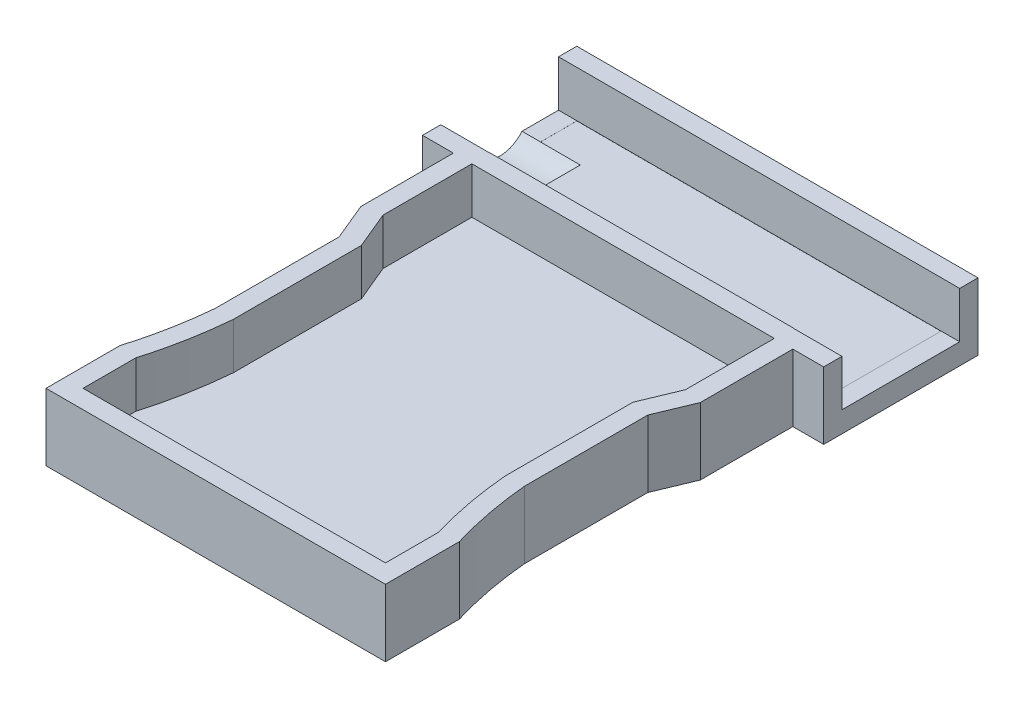
from build123d import *

# Parameters (mm, degrees)
BOSS_EXTRUDE1_DEPTH     = 18.415
CUT_EXTRUDE1_DEPTH      = 12.7
CUT_EXTRUDE2_DEPTH      = 116.078
CUT_EXTRUDE2_DEPTH_BACK = 116.078
SKETCH11_W              = 32.294856704
SKETCH11_H              = 12.721148442
SKETCH12_W              = 82.9732402
SKETCH12_H              = 5.08
BOSS_EXTRUDE3_DEPTH     = 12.7
SKETCH13_R              = 8.001
CUT_EXTRUDE3_DEPTH      = 16.002


with BuildPart() as part:
    # Sketch3 → Boss-Extrude1 (new body)
    with BuildSketch(Plane(origin=(0, 0, 0), x_dir=(1, 0, 0), z_dir=(0, 1, 0))):
        with BuildLine():
            Line((101.599873, 0), (110.066582, 0))
            Line((110.066582, 0), (110.066582, 42.333418))
            Line((110.066582, 42.333418), (55.033291, 42.333418))
            Line((55.033291, 42.333418), (8.4666328, 42.333418))
            Line((8.4666328, 42.333418), (0, 42.333418))
            Line((0, 42.333418), (0, 0))
            Line((0, 0), (8.4666328, 0))
            Line((8.4666328, 0), (8.4666328, -25.4))
            Line((8.4666328, -25.4), (12.6999492, -35.56))
            Line((12.6999492, -35.56), (12.6999492, -69.426582))
            add(Edge.make_bspline(
                [(12.6999492, -69.426582), (11.690404189, -80.766544706), (8.46666328, -91.44)],
                knots=[0, 0, 0, 0.504540069, 0.504540069, 0.504540069], degree=2))
            Line((8.46666328, -91.44), (8.46666328, -111.76))
            Line((8.46666328, -111.76), (101.599995682, -111.76))
            Line((101.599995682, -111.76), (101.599995682, -91.44))
            add(Edge.make_bspline(
                [(97.366709, -69.426582), (98.376270675, -80.766537876), (101.599995682, -91.44)],
                knots=[0, 0, 0, 0.504540407, 0.504540407, 0.504540407], degree=2))
            Line((97.366709, -69.426582), (97.366709, -35.56))
            Line((97.366709, -35.56), (101.599873, -25.4))
            Line((101.599873, -25.4), (101.599873, 0))
        make_face()
    extrude(amount=BOSS_EXTRUDE1_DEPTH)

    # Sketch7 → Cut-Extrude1 (cut)
    with BuildSketch(Plane(origin=(0, 18.415, 0), x_dir=(1, 0, 0), z_dir=(0, 1, 0))):
        with BuildLine():
            Line((104.986582, 5.08), (104.986582, 37.253418))
            Line((104.986582, 37.253418), (5.08, 37.253418))
            Line((5.08, 37.253418), (5.08, 5.08))
            Line((5.08, 5.08), (13.5466328, 5.08))
            Line((13.5466328, 5.08), (13.5466328, -24.384003751))
            Line((13.5466328, -24.384003751), (17.7799492, -34.544003751))
            Line((17.7799492, -34.544003751), (17.7799492, -69.649806794))
            add(Edge.make_bspline(
                [(13.54666328, -92.18157962), (15.696718758, -84.885689198), (17.107633166, -77.368389863), (17.7799492, -69.649806794)],
                knots=[0, 0, 0, 0, 1, 1, 1, 1], degree=3))
            Line((13.54666328, -92.18157962), (13.54666328, -106.68))
            Line((13.54666328, -106.68), (96.519995682, -106.68))
            Line((96.519995682, -106.68), (96.519995682, -92.1815758))
            add(Edge.make_bspline(
                [(92.286709, -69.649810631), (92.959036165, -77.368387225), (94.369950858, -84.885683715), (96.519995682, -92.1815758)],
                knots=[0, 0, 0, 0, 1, 1, 1, 1], degree=3))
            Line((92.286709, -69.649810631), (92.286709, -34.544037514))
            Line((92.286709, -34.544037514), (96.519873, -24.384037514))
            Line((96.519873, -24.384037514), (96.519873, 5.08))
            Line((96.519873, 5.08), (104.986582, 5.08))
        make_face()
    extrude(amount=-CUT_EXTRUDE1_DEPTH, mode=Mode.SUBTRACT)

    # Sketch11 → Cut-Extrude2 (cut, two sides: drawn at the far end of the back side and taken through both)
    with BuildSketch(Plane(origin=(105.08, 0, 0), x_dir=(0, 0, -1), z_dir=(1, 0, 0)).offset(-CUT_EXTRUDE2_DEPTH_BACK)):
        with Locations((21.166087112, 12.087958035)):
            Rectangle(SKETCH11_W, SKETCH11_H)
    extrude(amount=CUT_EXTRUDE2_DEPTH + CUT_EXTRUDE2_DEPTH_BACK, mode=Mode.SUBTRACT)

    # Sketch12 → Boss-Extrude3 (add)
    with BuildSketch(Plane(origin=(0, 18.415, 0), x_dir=(1, 0, 0), z_dir=(0, 1, 0))):
        with Locations((55.0332529, 2.54)):
            Rectangle(SKETCH12_W, SKETCH12_H)
    extrude(amount=-BOSS_EXTRUDE3_DEPTH)

    # Sketch13 → Cut-Extrude3 (cut)
    with BuildSketch(Plane.ZY):
        with Locations((-21.166398056, 10.864691907)):
            Circle(SKETCH13_R)
    extrude(amount=-CUT_EXTRUDE3_DEPTH, mode=Mode.SUBTRACT)


solid = part.part
